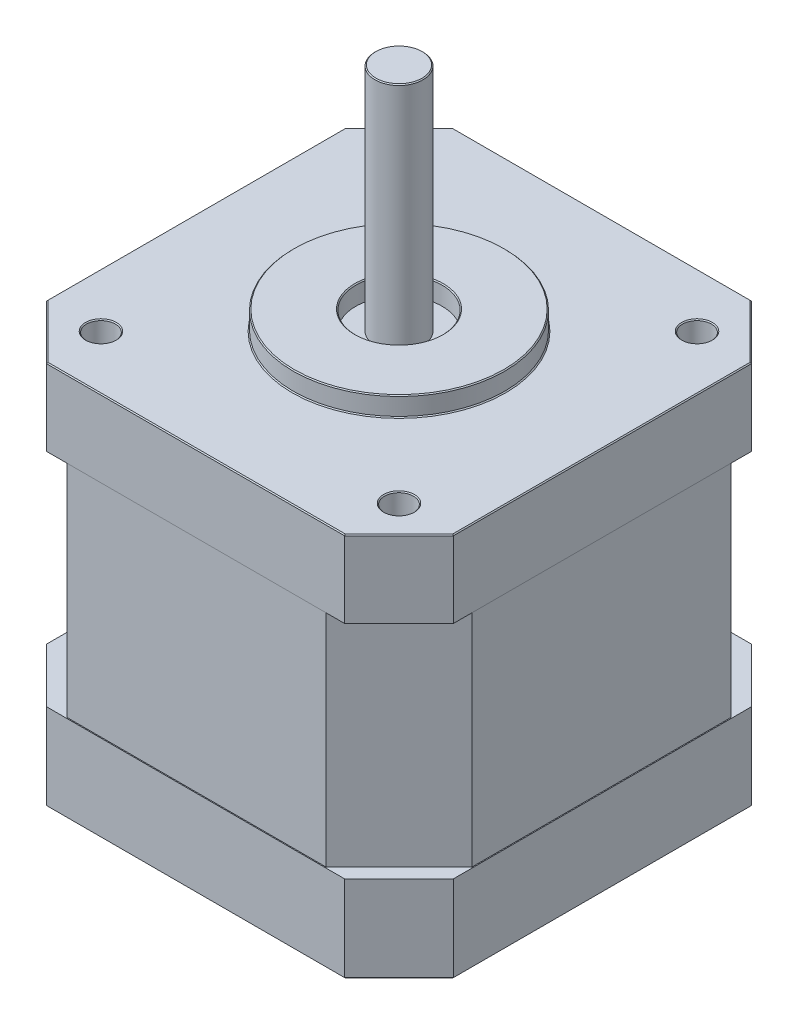
from build123d import *

# Parameters (mm, degrees)
SKETCH1_R           = 1.5
BOSS_EXTRUDE1_DEPTH = 9
SKETCH4_R           = 1.5
BOSS_EXTRUDE4_DEPTH = 23
SKETCH5_R           = 1.5
BOSS_EXTRUDE6_DEPTH = 8
SKETCH2_R           = 11
SKETCH2_R_2         = 4.5
BOSS_EXTRUDE2_DEPTH = 2
SKETCH3_R           = 2.5
BOSS_EXTRUDE3_DEPTH = 24
CHAMFER1_SIZE       = 0.1


with BuildPart() as part:
    # Sketch1 → Boss-Extrude1 (new body)
    with BuildSketch(Plane(origin=(0, 0, 0), x_dir=(1, 0, 0), z_dir=(0, 1, 0))):
        Polygon((-15.5, -21.15), (15.5, -21.15), (21.15, -15.5), (21.15, 15.5), (15.5, 21.15), (-15.5, 21.15), (-21.15, 15.5), (-21.15, -15.5), align=None)
        with Locations(Location((-15.5, 15.5, 0), (0, 0, 270))):
            Circle(SKETCH1_R, mode=Mode.SUBTRACT)
        with Locations(Location((15.5, -15.5, 0), (0, 0, 90))):
            Circle(SKETCH1_R, mode=Mode.SUBTRACT)
        with Locations(Location((15.5, 15.5, 0), (0, 0, 270))):
            Circle(SKETCH1_R, mode=Mode.SUBTRACT)
        with Locations(Location((-15.5, -15.5, 0), (0, 0, 90))):
            Circle(SKETCH1_R, mode=Mode.SUBTRACT)
    extrude(amount=BOSS_EXTRUDE1_DEPTH)

    # Sketch4 → Boss-Extrude4 (add)
    with BuildSketch(Plane(origin=(0, 9, 0), x_dir=(1, 0, 0), z_dir=(0, 1, 0))):
        Polygon((13.478679656, 21.05), (-13.478679656, 21.05), (-21.05, 13.478679656), (-21.05, -13.478679656), (-13.478679656, -21.05), (13.478679656, -21.05), (21.05, -13.478679656), (21.05, 13.478679656), align=None)
        with Locations(Location((-15.5, 15.5, 0), (0, 0, 270))):
            Circle(SKETCH4_R, mode=Mode.SUBTRACT)
        with Locations(Location((15.5, 15.5, 0), (0, 0, 270))):
            Circle(SKETCH4_R, mode=Mode.SUBTRACT)
        with Locations(Location((15.5, -15.5, 0), (0, 0, 90))):
            Circle(SKETCH4_R, mode=Mode.SUBTRACT)
        with Locations(Location((-15.5, -15.5, 0), (0, 0, 90))):
            Circle(SKETCH4_R, mode=Mode.SUBTRACT)
    extrude(amount=BOSS_EXTRUDE4_DEPTH)

    # Sketch5 → Boss-Extrude6 (add)
    with BuildSketch(Plane(origin=(0, 32, 0), x_dir=(1, 0, 0), z_dir=(0, 1, 0))):
        Polygon((-15.5, 21.15), (-21.15, 15.5), (-21.15, -15.5), (-15.5, -21.15), (15.5, -21.15), (21.15, -15.5), (21.15, 15.5), (15.5, 21.15), align=None)
        with Locations(Location((15.5, 15.5, 0), (0, 0, 270))):
            Circle(SKETCH5_R, mode=Mode.SUBTRACT)
        with Locations(Location((-15.5, 15.5, 0), (0, 0, 270))):
            Circle(SKETCH5_R, mode=Mode.SUBTRACT)
        with Locations(Location((-15.5, -15.5, 0), (0, 0, 90))):
            Circle(SKETCH5_R, mode=Mode.SUBTRACT)
        with Locations(Location((15.5, -15.5, 0), (0, 0, 90))):
            Circle(SKETCH5_R, mode=Mode.SUBTRACT)
    extrude(amount=BOSS_EXTRUDE6_DEPTH)

    # Sketch2 → Boss-Extrude2 (add)
    with BuildSketch(Plane(origin=(0, 40, 0), x_dir=(1, 0, 0), z_dir=(0, 1, 0))):
        with Locations(Location((0, 0, 0), (0, 0, 270))):
            Circle(SKETCH2_R)
        with Locations(Location((0, 0, 0), (0, 0, 270))):
            Circle(SKETCH2_R_2, mode=Mode.SUBTRACT)
    extrude(amount=BOSS_EXTRUDE2_DEPTH)

    # Sketch3 → Boss-Extrude3 (add)
    with BuildSketch(Plane(origin=(0, 40, 0), x_dir=(1, 0, 0), z_dir=(0, 1, 0))):
        with Locations(Location((0, 0, 0), (0, 0, 270))):
            Circle(SKETCH3_R)
    extrude(amount=BOSS_EXTRUDE3_DEPTH)

    # Chamfer1
    chamfer1_edges = [part.edges().sort_by_distance(p)[0] for p in [
        (-21.15, 0, 0),
        (-18.325, 0, -18.325),
        (0, 42, -11),
        (0, 40, -11),
        (0, 42, -4.5),
        (0, 64, -2.5),
        (-15.5, 0, -17),
        (15.5, 0, 17),
        (15.5, 0, -17),
        (-15.5, 0, 17),
        (0, 40, -21.15),
        (-18.325, 40, -18.325),
        (-21.15, 40, 0),
        (-18.325, 40, 18.325),
        (0, 40, 21.15),
        (18.325, 40, 18.325),
        (21.15, 40, 0),
        (18.325, 40, -18.325),
        (0, 0, -21.15),
        (15.5, 40, -17),
        (18.325, 0, -18.325),
        (-15.5, 40, -17),
        (-15.5, 40, 17),
        (15.5, 40, 17),
        (21.15, 0, 0),
        (18.325, 0, 18.325),
        (0, 0, 21.15),
        (-18.325, 0, 18.325),
    ]]
    chamfer(chamfer1_edges, length=CHAMFER1_SIZE)


solid = part.part
